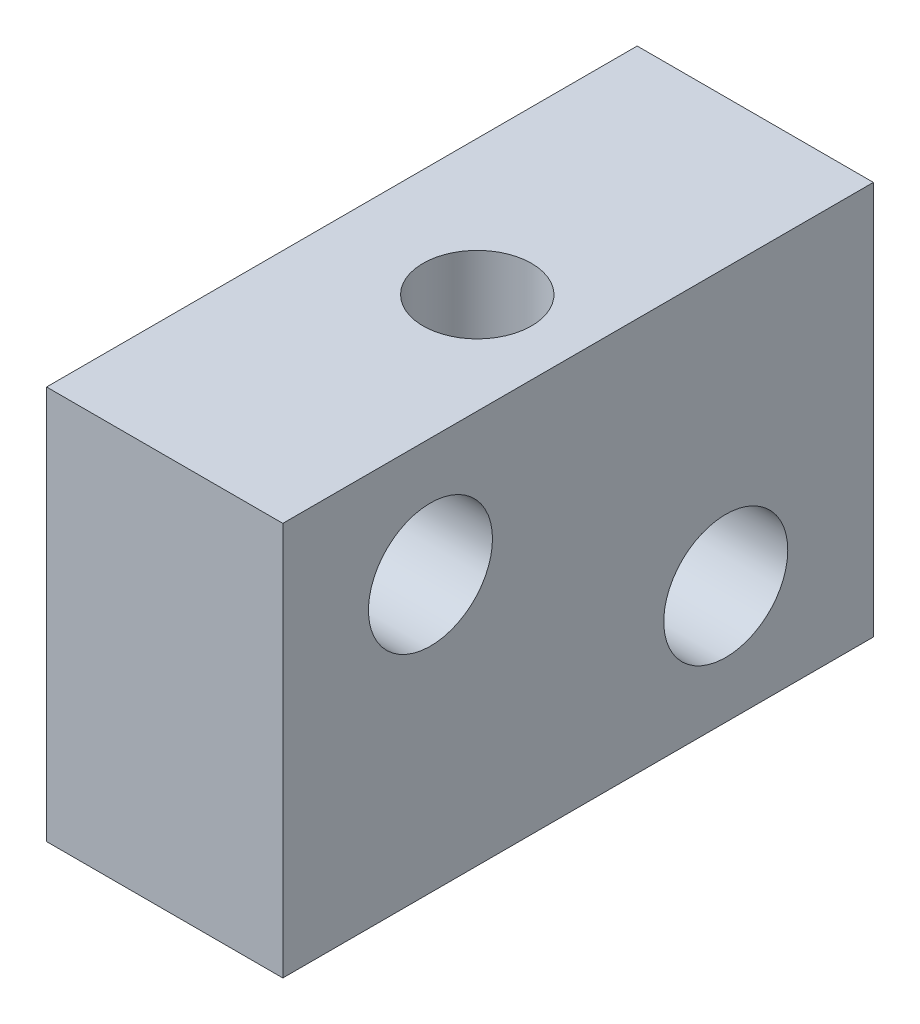
from build123d import *

# Parameters (mm, degrees)
SKETCH1_W           = 12.7
SKETCH1_H           = 19.05
BOSS_EXTRUDE1_DEPTH = 7.62
SKETCH3_R           = 1.75
CUT_EXTRUDE1_DEPTH  = 22.2885
SKETCH4_R           = 2
CUT_EXTRUDE2_DEPTH  = 22.2885


with BuildPart() as part:
    # Sketch1 → Boss-Extrude1 (new body)
    with BuildSketch(Plane.YZ):
        Rectangle(SKETCH1_W, SKETCH1_H)
    extrude(amount=BOSS_EXTRUDE1_DEPTH)

    # Sketch3 → Cut-Extrude1 (cut)
    with BuildSketch(Plane.XZ.offset(6.35)):
        with Locations((4.36625, 0)):
            Circle(SKETCH3_R)
    extrude(amount=-CUT_EXTRUDE1_DEPTH, mode=Mode.SUBTRACT)

    # Sketch4 → Cut-Extrude2 (cut)
    with BuildSketch(Plane.YZ.offset(7.62)):
        with Locations((2.54, 4.7625)):
            Circle(SKETCH4_R)
        with Locations((-2.54, -4.7625)):
            Circle(SKETCH4_R)
    extrude(amount=-CUT_EXTRUDE2_DEPTH, mode=Mode.SUBTRACT)


solid = part.part
